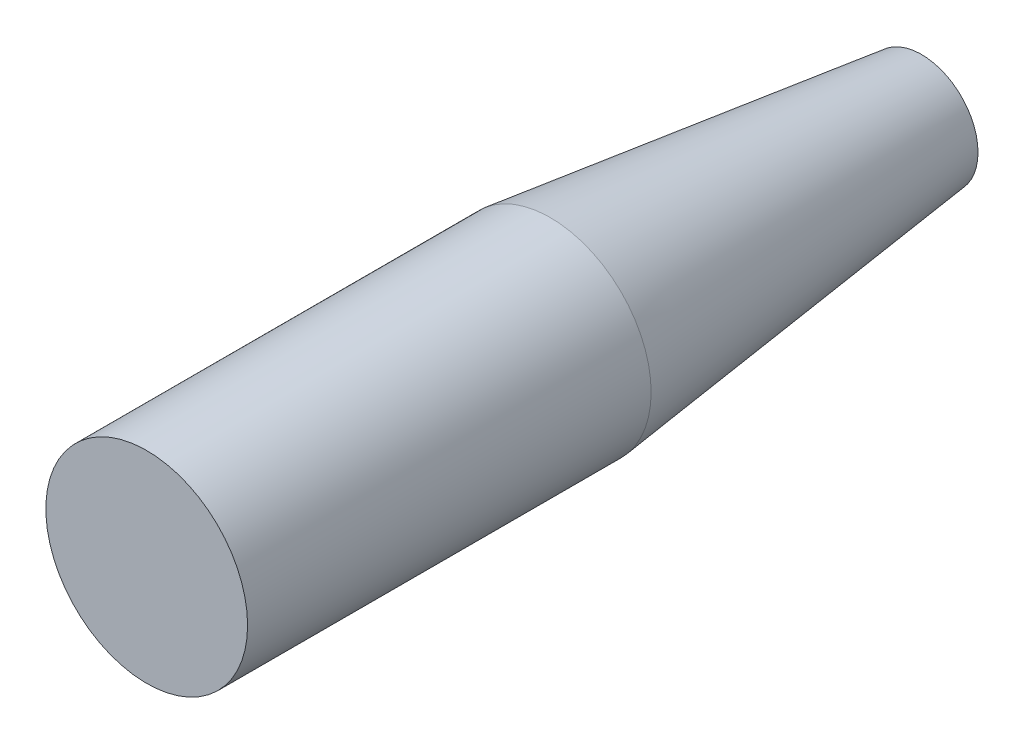
from build123d import *

# Parameters (mm, degrees)
SKETCH1_R           = 6.25
BOSS_EXTRUDE1_DEPTH = 25


with BuildPart() as part:
    # Sketch1 → Boss-Extrude1 (new body)
    with BuildSketch(Plane.XY):
        Circle(SKETCH1_R)
    extrude(amount=BOSS_EXTRUDE1_DEPTH)

    # Sketch2 → Revolve1 (revolve)
    with BuildSketch(Plane(origin=(0, 0, 0), x_dir=(1, 0, 0), z_dir=(0, 1, 0))):
        Polygon((0, 0), (6.25, 0), (3.5, 23), (2.5, 23), (2.5, 21), (0, 21), align=None)
    revolve(axis=Axis((0, 0, 25), (0, 0, -1)))


solid = part.part
